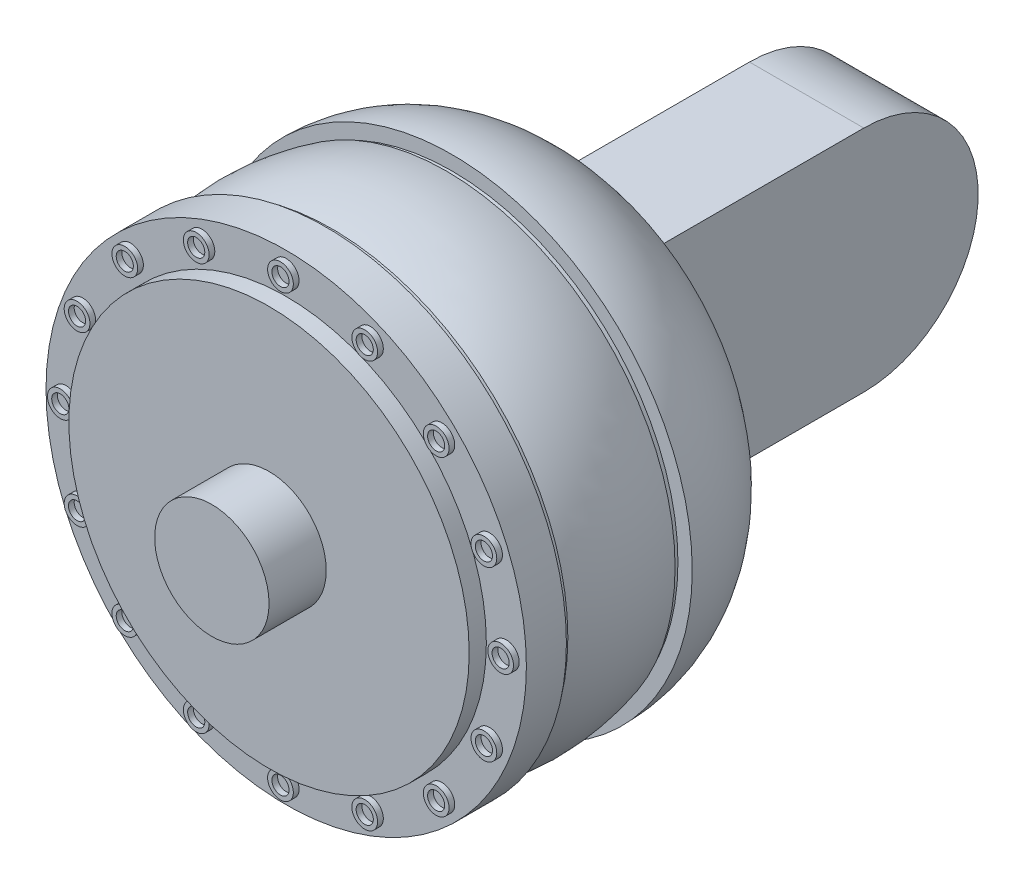
from build123d import *

# Parameters (mm, degrees)
SKETCH3_R            = 39.5
BOSS_EXTRUDE2_DEPTH  = 1
SKETCH5_R            = 41.25
BOSS_EXTRUDE3_DEPTH  = 1
SKETCH6_R            = 42
BOSS_EXTRUDE4_DEPTH  = 7
SKETCH7_R            = 35
BOSS_EXTRUDE5_DEPTH  = 3
BOSS_EXTRUDE6_DEPTH  = 1
CIRPATTERN1_COUNT    = 16
SKETCH9_W            = 20
SKETCH9_H            = 40
BOSS_EXTRUDE7_DEPTH  = 42
SKETCH10_R           = 20
BOSS_EXTRUDE9_DEPTH  = 20
SKETCH11_R           = 10
BOSS_EXTRUDE10_DEPTH = 10
SKETCH12_R           = 10
BOSS_EXTRUDE11_DEPTH = 10


with BuildPart() as part:
    # Sketch1 → Revolve1 (revolve)
    with BuildSketch(Plane(origin=(0, 0, 0), x_dir=(1, 0, 0), z_dir=(0, 1, 0)), mode=Mode.PRIVATE) as revolve1_sk:
        with BuildLine():
            Line((0, 0), (-42, 0))
            ThreePointArc((-42, 0), (-39.360679775, 11.180339887), (-32, 20))
            Line((-32, 20), (-12.315151515, 20))
            Line((-12.315151515, 20), (0, 20))
            Line((0, 20), (0, 0))
        make_face()
    revolve(revolve1_sk.sketch.rotate(Axis((0, 0, 0), (0, 0, -1)), 180), axis=Axis((0, 0, 0), (0, 0, -1)))

    # Sketch3 → Boss-Extrude2 (add)
    with BuildSketch(Plane.XY):
        Circle(SKETCH3_R)
    extrude(amount=BOSS_EXTRUDE2_DEPTH)

    # Sketch4 → Revolve2 (revolve)
    with BuildSketch(Plane(origin=(0, 0, 0), x_dir=(1, 0, 0), z_dir=(0, 1, 0)), mode=Mode.PRIVATE) as revolve2_sk:
        with BuildLine():
            Line((0, -1), (-40, -1))
            ThreePointArc((-40, -1), (-41.376973739, -11), (-40, -21))
            Line((-40, -21), (0, -21))
            Line((0, -21), (0, -1))
        make_face()
    revolve(revolve2_sk.sketch.rotate(Axis((0, 0, 1), (0, 0, 1)), 180), axis=Axis((0, 0, 1), (0, 0, 1)))

    # Sketch5 → Boss-Extrude3 (add)
    with BuildSketch(Plane.XY.offset(21)):
        Circle(SKETCH5_R)
    extrude(amount=BOSS_EXTRUDE3_DEPTH)

    # Sketch6 → Boss-Extrude4 (add)
    with BuildSketch(Plane.XY.offset(22)):
        Circle(SKETCH6_R)
    extrude(amount=BOSS_EXTRUDE4_DEPTH)

    # Sketch7 → Boss-Extrude5 (add)
    with BuildSketch(Plane.XY.offset(29)):
        Circle(SKETCH7_R)
    extrude(amount=BOSS_EXTRUDE5_DEPTH)

    # Sketch8 → Boss-Extrude6 (add)
    with BuildSketch(Plane.XY.offset(29)):
        with BuildLine():
            ThreePointArc((37, 0), (38.5, 1.5), (40, 0))
            Line((40, 0), (40.75, 0))
            ThreePointArc((40.75, 0), (38.5, 2.25), (36.25, 0))
            Line((36.25, 0), (37, 0))
        make_face()
        with BuildLine():
            Line((40.75, 0), (40, 0))
            ThreePointArc((40, 0), (38.5, -1.5), (37, 0))
            Line((37, 0), (36.25, 0))
            ThreePointArc((36.25, 0), (38.5, -2.25), (40.75, 0))
        make_face()
    boss_extrude6 = extrude(amount=BOSS_EXTRUDE6_DEPTH)

    # CirPattern1: Boss-Extrude6 ×16 about axis
    cirpattern1_axis = Axis((0, 0, 0), (0, 0, 1))
    for i in range(1, CIRPATTERN1_COUNT):
        add(boss_extrude6.rotate(cirpattern1_axis, i * 360 / CIRPATTERN1_COUNT))

    # Sketch9 → Boss-Extrude7 (add)
    with BuildSketch(Plane(origin=(0, 0, -20), x_dir=(-1, 0, 0), z_dir=(0, 0, -1))):
        Rectangle(SKETCH9_W, SKETCH9_H)
    extrude(amount=BOSS_EXTRUDE7_DEPTH)

    # Sketch10 → Boss-Extrude9 (add)
    with BuildSketch(Plane.ZY.offset(10)):
        with Locations((-62, 0)):
            Circle(SKETCH10_R)
    extrude(amount=-BOSS_EXTRUDE9_DEPTH)

    # Sketch11 → Boss-Extrude10 (add)
    with BuildSketch(Plane.ZY.offset(10)):
        with Locations(Location((-65.019975945, 0, 0), (0, 0, 90))):
            Circle(SKETCH11_R)
    extrude(amount=BOSS_EXTRUDE10_DEPTH)

    # Sketch12 → Boss-Extrude11 (add)
    with BuildSketch(Plane.XY.offset(32)):
        Circle(SKETCH12_R)
    extrude(amount=BOSS_EXTRUDE11_DEPTH)


solid = part.part
